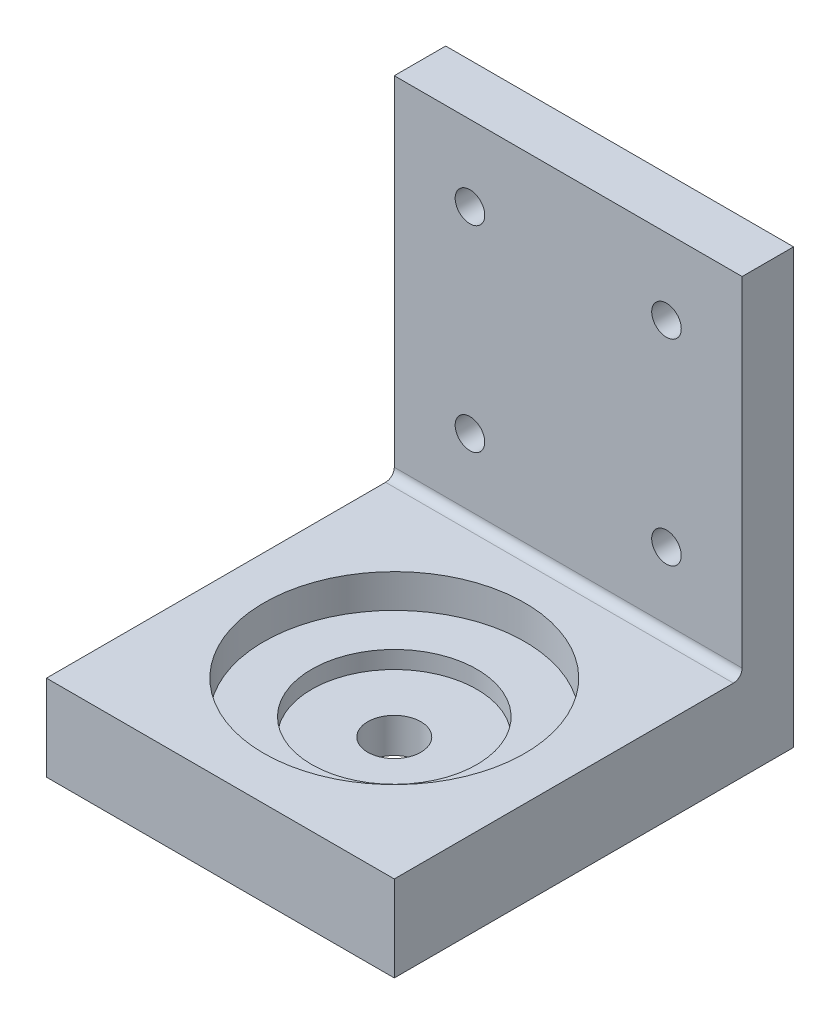
from build123d import *

# Parameters (mm, degrees)
SKETCH1_W           = 40
SKETCH1_H           = 40
BOSS_EXTRUDE1_DEPTH = 9.864848297
SKETCH2_R           = 15
CUT_EXTRUDE1_DEPTH  = 3.86
SKETCH3_R           = 9.5
CUT_EXTRUDE2_DEPTH  = 2
SKETCH4_R           = 3.05
CUT_EXTRUDE3_DEPTH  = 57.871254602
SKETCH5_W           = 40
SKETCH5_H           = 5.913501164
BOSS_EXTRUDE3_DEPTH = 49.86
SKETCH7_R           = 1.7
CUT_EXTRUDE4_DEPTH  = 76.40570005
FILLET2_R           = 1


with BuildPart() as part:
    # Sketch1 → Boss-Extrude1 (new body)
    with BuildSketch(Plane(origin=(0, 0, 0), x_dir=(1, 0, 0), z_dir=(0, 1, 0))):
        with Locations((20, -20)):
            Rectangle(SKETCH1_W, SKETCH1_H)
    extrude(amount=BOSS_EXTRUDE1_DEPTH)

    # Sketch2 → Cut-Extrude1 (cut)
    with BuildSketch(Plane(origin=(0, 9.864848297, 0), x_dir=(1, 0, 0), z_dir=(0, 1, 0))):
        with Locations(Location((20, -20, 0), (0, 0, 270))):
            Circle(SKETCH2_R)
    extrude(amount=-CUT_EXTRUDE1_DEPTH, mode=Mode.SUBTRACT)

    # Sketch3 → Cut-Extrude2 (cut)
    with BuildSketch(Plane(origin=(0, 6.004848297, 0), x_dir=(1, 0, 0), z_dir=(0, 1, 0))):
        with Locations(Location((20, -20, 0), (0, 0, 270))):
            Circle(SKETCH3_R)
    extrude(amount=-CUT_EXTRUDE2_DEPTH, mode=Mode.SUBTRACT)

    # Sketch4 → Cut-Extrude3 (cut, through all)
    with BuildSketch(Plane(origin=(0, 4.004848297, 0), x_dir=(1, 0, 0), z_dir=(0, 1, 0))):
        with Locations(Location((20, -20, 0), (0, 0, 270))):
            Circle(SKETCH4_R)
    extrude(amount=-CUT_EXTRUDE3_DEPTH, mode=Mode.SUBTRACT)

    # Sketch5 → Boss-Extrude3 (add)
    with BuildSketch(Plane(origin=(0, 0, 0), x_dir=(1, 0, 0), z_dir=(0, 1, 0))):
        with Locations((20, 2.956750582)):
            Rectangle(SKETCH5_W, SKETCH5_H)
    extrude(amount=BOSS_EXTRUDE3_DEPTH)

    # Sketch7 → Cut-Extrude4 (cut, through all)
    with BuildSketch(Plane.XY):
        with Locations((8.7, 18.564848297)):
            Circle(SKETCH7_R)
        with Locations((31.3, 18.564848297)):
            Circle(SKETCH7_R)
        with Locations((31.3, 41.16)):
            Circle(SKETCH7_R)
        with Locations((8.7, 41.16)):
            Circle(SKETCH7_R)
    extrude(amount=-CUT_EXTRUDE4_DEPTH, mode=Mode.SUBTRACT)

    # Fillet2
    fillet2_edges = [part.edges().sort_by_distance(p)[0] for p in [
        (20, 9.864848297, 0),
    ]]
    fillet(fillet2_edges, radius=FILLET2_R)


solid = part.part
